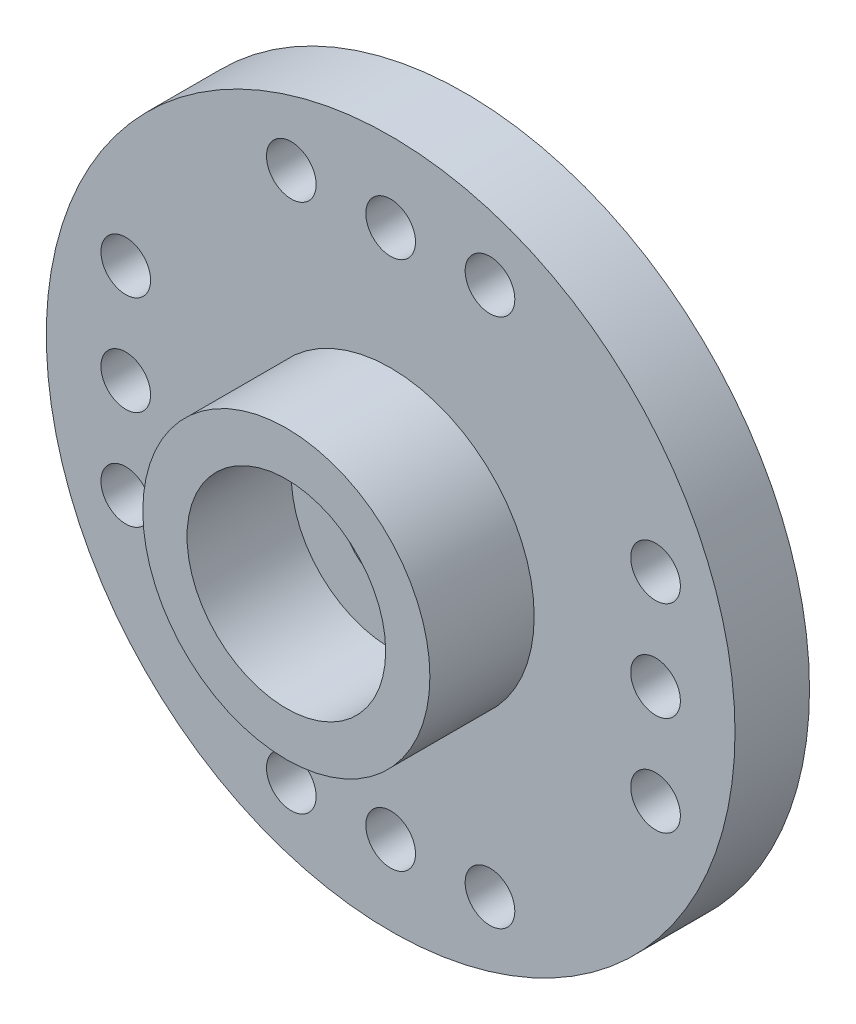
from build123d import *

# Parameters (mm, degrees)
SKETCH1_R           = 10.4
BOSS_EXTRUDE1_DEPTH = 2.25
SKETCH2_R           = 4.335
SKETCH2_R_2         = 3
BOSS_EXTRUDE2_DEPTH = 3.15
SKETCH3_R           = 1.5
CUT_EXTRUDE1_DEPTH  = 3.15
SKETCH4_R           = 0.75
CUT_EXTRUDE2_DEPTH  = 3.15


with BuildPart() as part:
    # Sketch1 → Boss-Extrude1 (new body)
    with BuildSketch(Plane.XY):
        Circle(SKETCH1_R)
    extrude(amount=BOSS_EXTRUDE1_DEPTH)

    # Sketch2 → Boss-Extrude2 (add)
    with BuildSketch(Plane.XY.offset(2.25)):
        Circle(SKETCH2_R)
        Circle(SKETCH2_R_2, mode=Mode.SUBTRACT)
    extrude(amount=BOSS_EXTRUDE2_DEPTH)

    # Sketch3 → Cut-Extrude1 (cut)
    with BuildSketch(Plane.XY.offset(2.25)):
        Circle(SKETCH3_R)
    extrude(amount=-CUT_EXTRUDE1_DEPTH, mode=Mode.SUBTRACT)

    # Sketch4 → Cut-Extrude2 (cut)
    with BuildSketch(Plane.XY.offset(2.25)):
        with Locations((0, 8)):
            Circle(SKETCH4_R)
        with Locations((3, 8)):
            Circle(SKETCH4_R)
        with Locations((-3, 8)):
            Circle(SKETCH4_R)
        with Locations((8, -3)):
            Circle(SKETCH4_R)
        with Locations((8, 0)):
            Circle(SKETCH4_R)
        with Locations((8, 3)):
            Circle(SKETCH4_R)
        with Locations((-3, -8)):
            Circle(SKETCH4_R)
        with Locations((0, -8)):
            Circle(SKETCH4_R)
        with Locations((3, -8)):
            Circle(SKETCH4_R)
        with Locations((-8, 3)):
            Circle(SKETCH4_R)
        with Locations((-8, 0)):
            Circle(SKETCH4_R)
        with Locations((-8, -3)):
            Circle(SKETCH4_R)
    extrude(amount=-CUT_EXTRUDE2_DEPTH, mode=Mode.SUBTRACT)


solid = part.part
